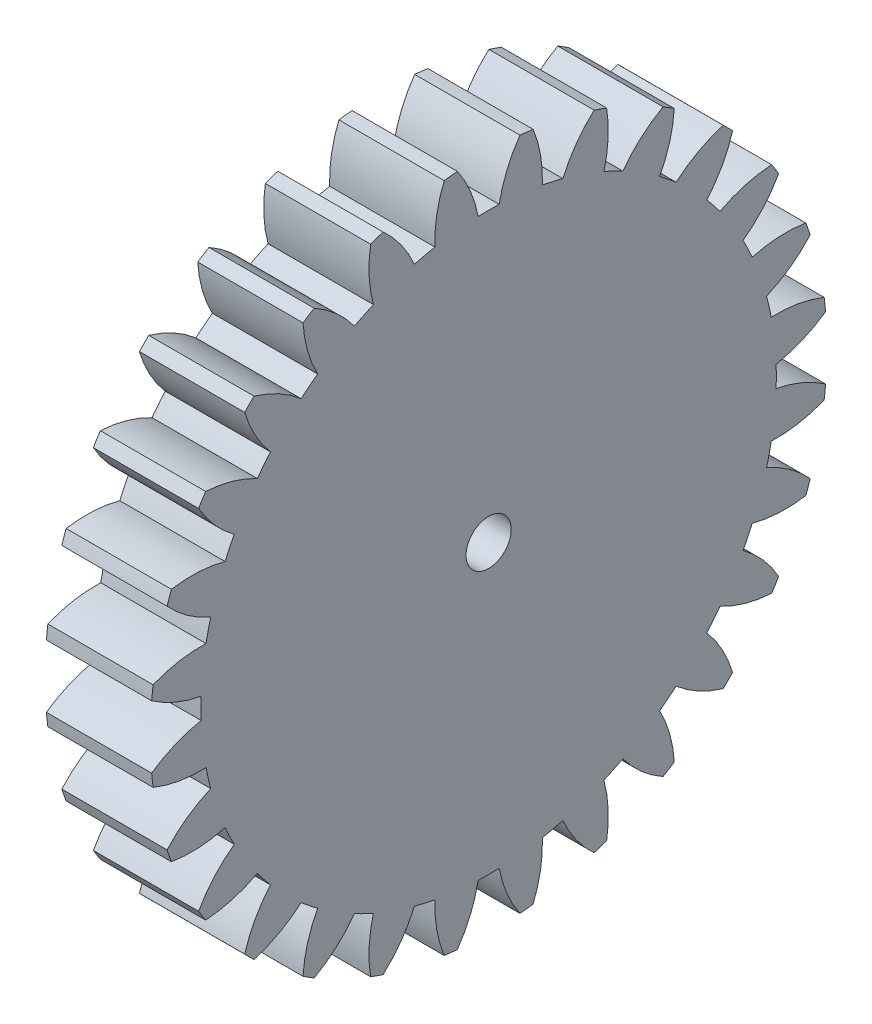
from build123d import *

# Parameters (mm, degrees)
BASPROSKE_W     = 7
BASPROSKE_H     = 22.5
TOOTHCUT_DEPTH  = 33.580669115
TEETHCUTS_COUNT = 28
TEETHCUTS_ANGLE = 347.142857143
BORSKE_R        = 1.5
BORE_DEPTH      = 50.0000508


with BuildPart() as part:
    # BasProSke → Base-Revolve (revolve)
    with BuildSketch(Plane(origin=(0, 0, 0), x_dir=(1, 0, 0), z_dir=(0, 1, 0)), mode=Mode.PRIVATE) as base_revolve_sk:
        with Locations((3.5, 11.25)):
            Rectangle(BASPROSKE_W, BASPROSKE_H)
    revolve(base_revolve_sk.sketch.rotate(Axis((-10, 0, 0), (1, 0, 0)), 180), axis=Axis((-10, 0, 0), (1, 0, 0)))

    # TooCutSke → ToothCut (cut, through all)
    with BuildSketch(Plane(origin=(0, 0, 0), x_dir=(0, 0, -1), z_dir=(1, 0, 0))):
        with BuildLine():
            ThreePointArc((0.70071741, 19.111158288), (0, 19.124), (-0.70071741, 19.111158288))
            ThreePointArc((-0.70071741, 19.111158288), (-1.220048441, 20.845037035), (-2.098754998, 22.427413418))
            ThreePointArc((-2.098754998, 22.427413418), (0, 22.5254), (2.098754998, 22.427413418))
            ThreePointArc((2.098754998, 22.427413418), (1.220048441, 20.845037035), (0.70071741, 19.111158288))
        make_face()
    toothcut = extrude(amount=TOOTHCUT_DEPTH, mode=Mode.SUBTRACT)

    # TeethCuts: ToothCut ×28 about axis
    teethcuts_axis = Axis((-10, 0, 0), (1, 0, 0))
    for i in range(1, TEETHCUTS_COUNT):
        add(toothcut.rotate(teethcuts_axis, i * TEETHCUTS_ANGLE / (TEETHCUTS_COUNT - 1)), mode=Mode.SUBTRACT)

    # BorSke → Bore (cut, symmetric)
    with BuildSketch(Plane(origin=(0, 0, 0), x_dir=(0, 0, -1), z_dir=(1, 0, 0))):
        with Locations(Location((0, 0, 0), (0, 0, 180))):
            Circle(BORSKE_R)
    extrude(amount=BORE_DEPTH, both=True, mode=Mode.SUBTRACT)


solid = part.part
